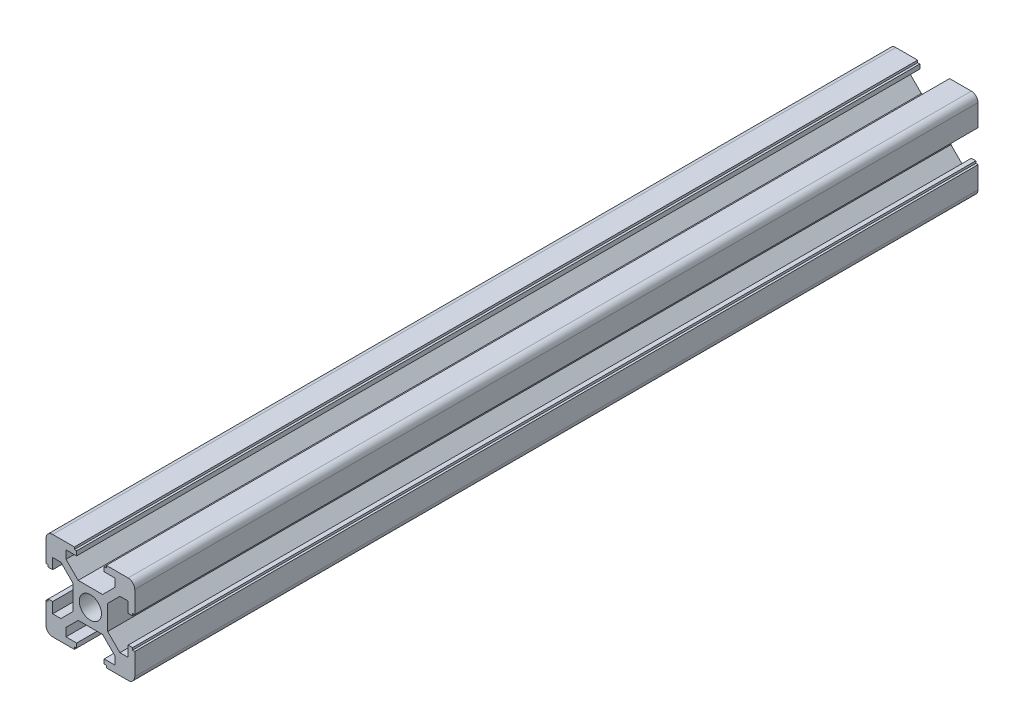
from build123d import *

# Parameters (mm, degrees)
SKETCH_2_R      = 2.5
EXTRUDE_1_DEPTH = 190


with BuildPart() as part:
    # 草图2 → 凸台-拉伸1 (new body)
    with BuildSketch(Plane.XY):
        with BuildLine():
            Line((-3.6, 10), (-3.6, 9.5))
            Line((-3.6, 9.5), (-3.1, 9.5))
            Line((-3.1, 9.5), (-3.1, 8.5))
            Line((-3.1, 8.5), (-5.5, 8.5))
            Line((-5.5, 8.5), (-5.5, 6.65))
            Line((-5.5, 6.65), (-2.75, 3.9))
            Line((-2.75, 3.9), (2.75, 3.9))
            Line((2.75, 3.9), (5.5, 6.65))
            Line((5.5, 6.65), (5.5, 8.5))
            Line((5.5, 8.5), (3.1, 8.5))
            Line((3.1, 8.5), (3.1, 9.5))
            Line((3.1, 9.5), (3.6, 9.5))
            Line((3.6, 9.5), (3.6, 10))
            Line((3.6, 10), (8.5, 10))
            ThreePointArc((8.5, 10), (9.560660172, 9.560660172), (10, 8.5))
            Line((10, 8.5), (10, 3.6))
            Line((10, 3.6), (9.5, 3.6))
            Line((9.5, 3.6), (9.5, 3.1))
            Line((9.5, 3.1), (8.5, 3.1))
            Line((8.5, 3.1), (8.5, 5.5))
            Line((8.5, 5.5), (6.65, 5.5))
            Line((6.65, 5.5), (3.9, 2.75))
            Line((3.9, 2.75), (3.9, -2.75))
            Line((3.9, -2.75), (6.65, -5.5))
            Line((6.65, -5.5), (8.5, -5.5))
            Line((8.5, -5.5), (8.5, -3.1))
            Line((8.5, -3.1), (9.5, -3.1))
            Line((9.5, -3.1), (9.5, -3.6))
            Line((9.5, -3.6), (10, -3.6))
            Line((10, -3.6), (10, -8.5))
            ThreePointArc((10, -8.5), (9.560660172, -9.560660172), (8.5, -10))
            Line((8.5, -10), (3.6, -10))
            Line((3.6, -10), (3.6, -9.5))
            Line((3.6, -9.5), (3.1, -9.5))
            Line((3.1, -9.5), (3.1, -8.5))
            Line((3.1, -8.5), (5.5, -8.5))
            Line((5.5, -8.5), (5.5, -6.65))
            Line((5.5, -6.65), (2.75, -3.9))
            Line((2.75, -3.9), (-2.75, -3.9))
            Line((-2.75, -3.9), (-5.5, -6.65))
            Line((-5.5, -6.65), (-5.5, -8.5))
            Line((-5.5, -8.5), (-3.1, -8.5))
            Line((-3.1, -8.5), (-3.1, -9.5))
            Line((-3.1, -9.5), (-3.6, -9.5))
            Line((-3.6, -9.5), (-3.6, -10))
            Line((-3.6, -10), (-8.5, -10))
            ThreePointArc((-8.5, -10), (-9.560660172, -9.560660172), (-10, -8.5))
            Line((-10, -8.5), (-10, -3.6))
            Line((-10, -3.6), (-9.5, -3.6))
            Line((-9.5, -3.6), (-9.5, -3.1))
            Line((-9.5, -3.1), (-8.5, -3.1))
            Line((-8.5, -3.1), (-8.5, -5.5))
            Line((-8.5, -5.5), (-6.65, -5.5))
            Line((-6.65, -5.5), (-3.9, -2.75))
            Line((-3.9, -2.75), (-3.9, 2.75))
            Line((-3.9, 2.75), (-6.65, 5.5))
            Line((-6.65, 5.5), (-8.5, 5.5))
            Line((-8.5, 5.5), (-8.5, 3.1))
            Line((-8.5, 3.1), (-9.5, 3.1))
            Line((-9.5, 3.1), (-9.5, 3.6))
            Line((-9.5, 3.6), (-10, 3.6))
            Line((-10, 3.6), (-10, 8.5))
            ThreePointArc((-10, 8.5), (-9.560660172, 9.560660172), (-8.5, 10))
            Line((-8.5, 10), (-3.6, 10))
        make_face()
        Circle(SKETCH_2_R, mode=Mode.SUBTRACT)
    extrude(amount=EXTRUDE_1_DEPTH)


solid = part.part
